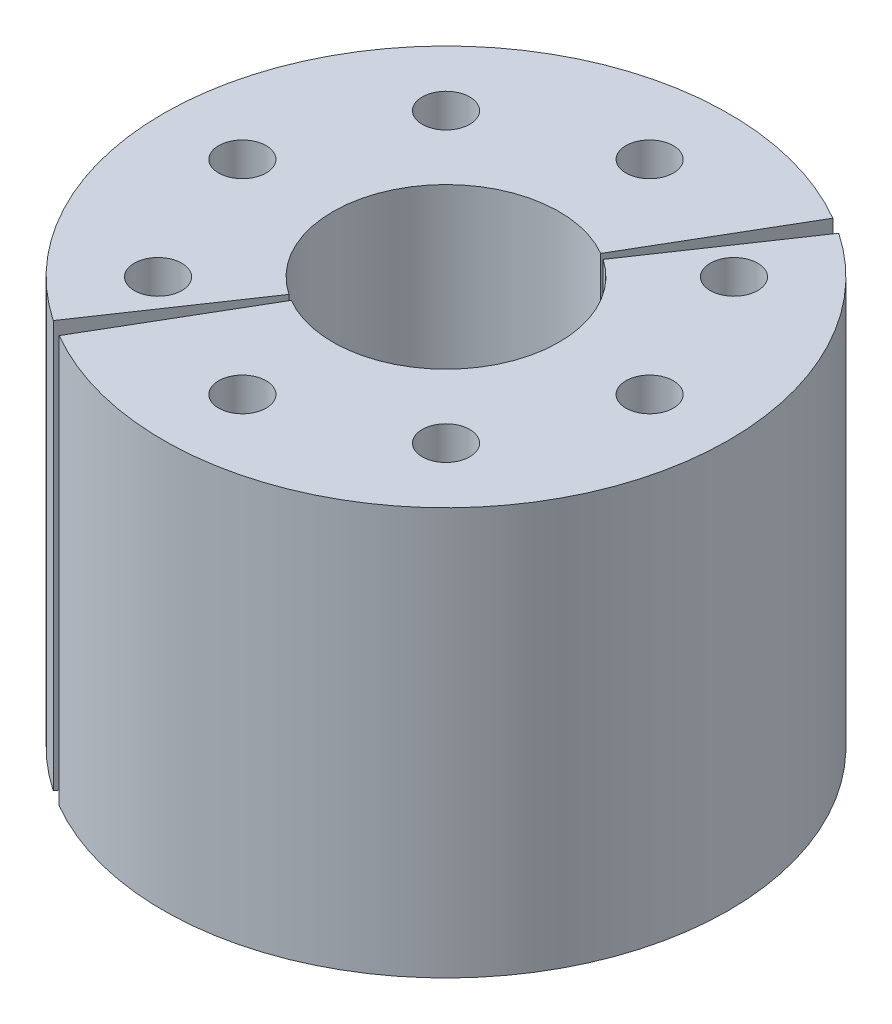
from build123d import *

# Parameters (mm, degrees)
SKETCH_1_R        = 2.1
EXTRUDE_1_DEPTH   = 36
EXTRUDE_1_2_DEPTH = 36


with BuildPart() as part:
    # Эскиз1 → Бобышка-Вытянуть1 (new body)
    with BuildSketch(Plane(origin=(0, 0, 0), x_dir=(1, 0, 0), z_dir=(0, 1, 0))):
        with BuildLine():
            Line((-14.015859913, -20.701586193), (-5.606343965, -8.280634477))
            ThreePointArc((-5.606343965, -8.280634477), (-8.46332743, 5.326545673), (5.040799558, 8.63656991))
            Line((5.040799558, 8.63656991), (12.601998896, 21.591424775))
            ThreePointArc((12.601998896, 21.591424775), (-21.158318575, 13.316364183), (-14.015859913, -20.701586193))
        make_face()
        with Locations(Location((-12.727922061, -12.727922061, 0), (0, 0, 270))):
            Circle(SKETCH_1_R, mode=Mode.SUBTRACT)
        with Locations(Location((-18, 0, 0), (0, 0, 270))):
            Circle(SKETCH_1_R, mode=Mode.SUBTRACT)
        with Locations(Location((-12.727922061, 12.727922061, 0), (0, 0, 270))):
            Circle(SKETCH_1_R, mode=Mode.SUBTRACT)
        with Locations(Location((0, 18, 0), (0, 0, 270))):
            Circle(SKETCH_1_R, mode=Mode.SUBTRACT)
    extrude(amount=EXTRUDE_1_DEPTH)


with BuildPart() as body_2:
    # Эскиз1 → Extrude 1 2 (new body)
    with BuildSketch(Plane(origin=(0, 0, 0), x_dir=(1, 0, 0), z_dir=(0, 1, 0))):
        with BuildLine():
            ThreePointArc((10, 0), (4.979558435, -8.672023858), (-5.040799558, -8.63656991))
            Line((-5.040799558, -8.63656991), (-12.601998896, -21.591424775))
            ThreePointArc((-12.601998896, -21.591424775), (12.448896088, -21.680059645), (25, 0))
            ThreePointArc((25, 0), (22.083891163, 11.717582988), (14.015859913, 20.701586193))
            Line((14.015859913, 20.701586193), (5.606343965, 8.280634477))
            ThreePointArc((5.606343965, 8.280634477), (8.833556465, 4.687033195), (10, 0))
        make_face()
        with Locations(Location((0, -18, 0), (0, 0, 270))):
            Circle(SKETCH_1_R, mode=Mode.SUBTRACT)
        with Locations(Location((12.727922061, -12.727922061, 0), (0, 0, 270))):
            Circle(SKETCH_1_R, mode=Mode.SUBTRACT)
        with Locations(Location((18, 0, 0), (0, 0, 270))):
            Circle(SKETCH_1_R, mode=Mode.SUBTRACT)
        with Locations(Location((12.727922061, 12.727922061, 0), (0, 0, 270))):
            Circle(SKETCH_1_R, mode=Mode.SUBTRACT)
    extrude(amount=EXTRUDE_1_2_DEPTH)


solid = Compound([part.part, body_2.part])
